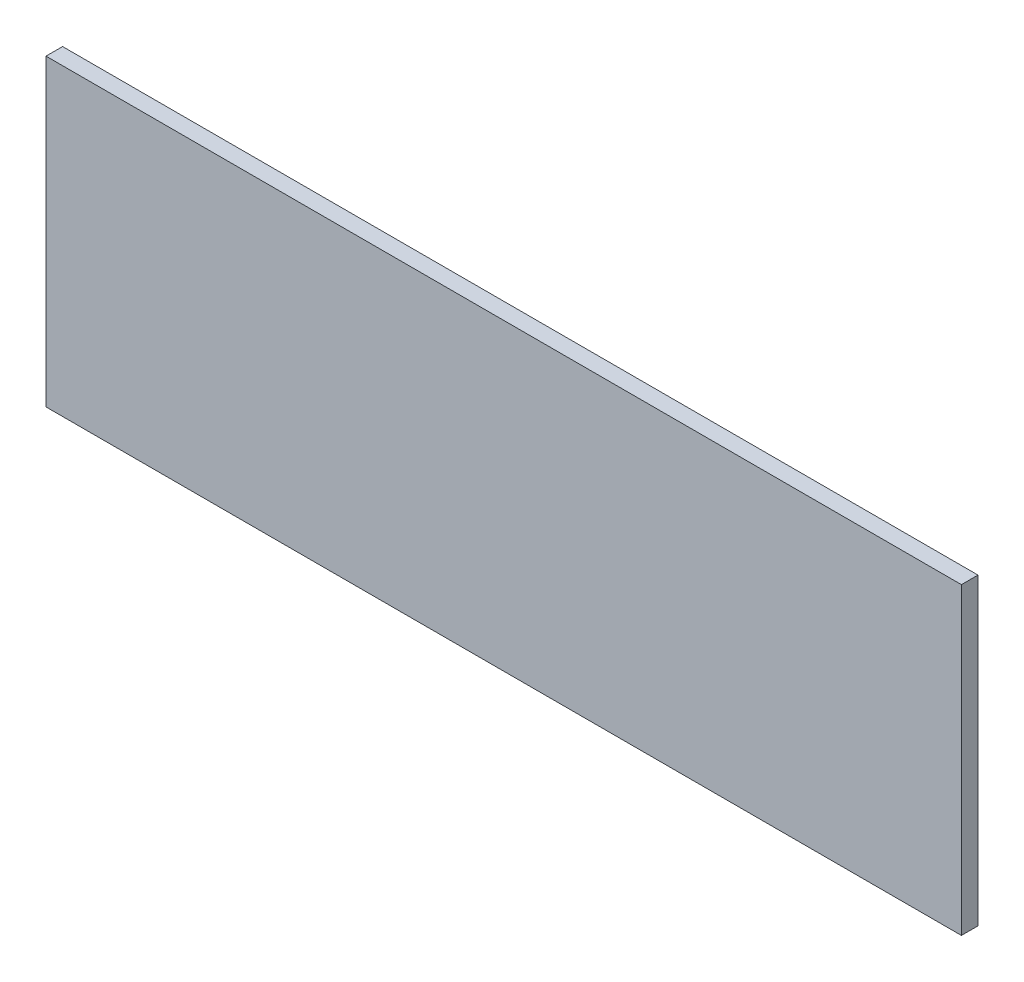
from build123d import *

# Parameters (mm, degrees)
SKETCH1_W           = 254
SKETCH1_H           = 84.300000056
BOSS_EXTRUDE1_DEPTH = 4.599999944


with BuildPart() as part:
    # Sketch1 → Boss-Extrude1 (new body)
    with BuildSketch(Plane.XY):
        with Locations((127, 42.150000028)):
            Rectangle(SKETCH1_W, SKETCH1_H)
    extrude(amount=BOSS_EXTRUDE1_DEPTH)


solid = part.part
